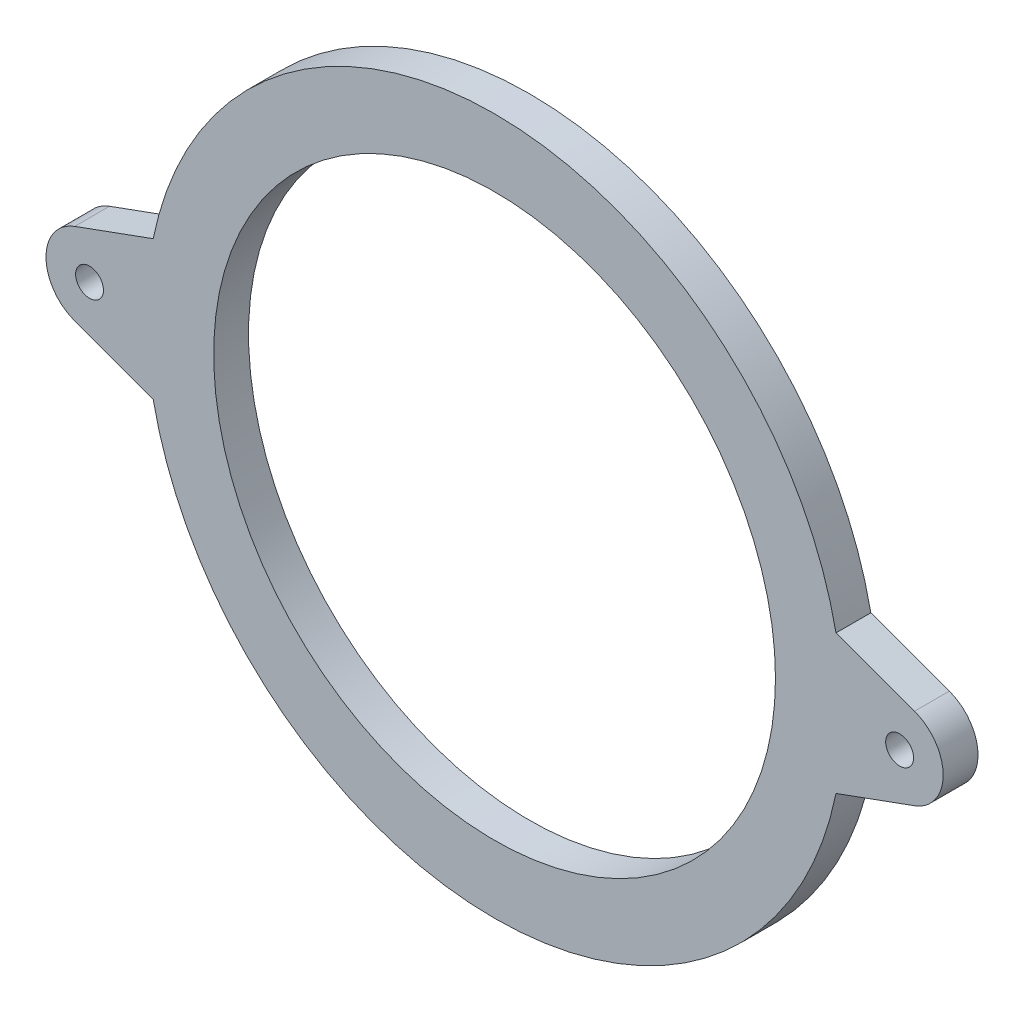
from build123d import *

# Parameters (mm, degrees)
SKETCH_1_R      = 40
SKETCH_1_R_2    = 32.25
EXTRUDE_1_DEPTH = 4
SKETCH_2_R      = 1.6
EXTRUDE_2_DEPTH = 4


with BuildPart() as part:
    # 草图1 → 凸台-拉伸1 (new body)
    with BuildSketch(Plane.XY):
        Circle(SKETCH_1_R)
        Circle(SKETCH_1_R_2, mode=Mode.SUBTRACT)
    extrude(amount=EXTRUDE_1_DEPTH)

    # 草图2 → 凸台-拉伸2 (add)
    # profile 1 of 2: a face of its own
    with BuildSketch(Plane(origin=(0, 0, 0), x_dir=(-1, 0, 0), z_dir=(0, 0, -1))):
        with BuildLine():
            Line((48.210100717, 4.698463104), (39.196053971, 7.97930781))
            ThreePointArc((39.196053971, 7.97930781), (40, 0), (39.196053971, -7.97930781))
            Line((39.196053971, -7.97930781), (48.210100717, -4.698463104))
            ThreePointArc((48.210100717, -4.698463104), (51.5, 0), (48.210100717, 4.698463104))
        make_face()
        with Locations((46.5, 0)):
            Circle(SKETCH_2_R, mode=Mode.SUBTRACT)
    # profile 2 of 2: a face of its own
    with BuildSketch(Plane(origin=(0, 0, 0), x_dir=(-1, 0, 0), z_dir=(0, 0, -1))):
        with BuildLine():
            Line((-48.210100717, -4.698463104), (-39.196053971, -7.97930781))
            ThreePointArc((-39.196053971, -7.97930781), (-40, 0), (-39.196053971, 7.97930781))
            Line((-39.196053971, 7.97930781), (-48.210100717, 4.698463104))
            ThreePointArc((-48.210100717, 4.698463104), (-51.5, 0), (-48.210100717, -4.698463104))
        make_face()
        with Locations(Location((-46.5, 0, 0), (0, 0, 180))):
            Circle(SKETCH_2_R, mode=Mode.SUBTRACT)
    extrude(amount=-EXTRUDE_2_DEPTH)


solid = part.part
